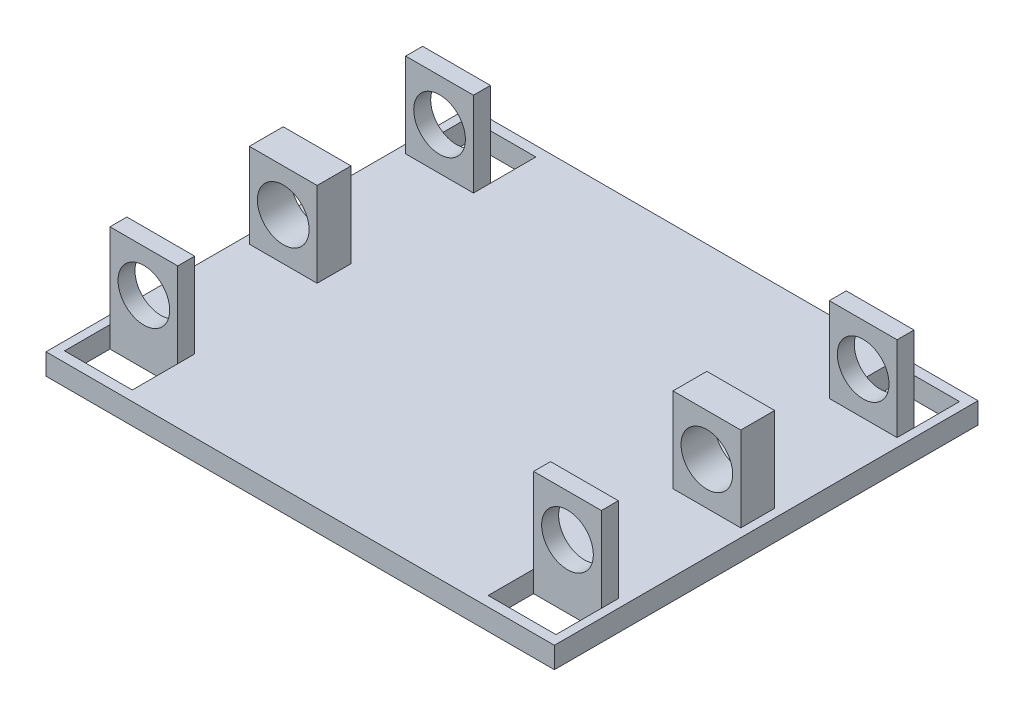
from build123d import *

# Parameters (mm, degrees)
SKETCH1_W           = 60
SKETCH1_H           = 50
BOSS_EXTRUDE1_DEPTH = 2.5
SKETCH2_W           = 8
SKETCH2_H           = 2
BOSS_EXTRUDE2_DEPTH = 10
CUT_EXTRUDE1_REACH  = 44.252
SKETCH3_R           = 3.05
SKETCH4_W           = 8
SKETCH4_H           = 2
BOSS_EXTRUDE3_DEPTH = 10
CUT_EXTRUDE2_REACH  = 44.252
SKETCH6_R           = 3.05
SKETCH7_W           = 8
SKETCH7_H           = 4
BOSS_EXTRUDE4_DEPTH = 10
CUT_EXTRUDE3_REACH  = 44.252
SKETCH8_R           = 3.05
SKETCH9_W           = 8
SKETCH9_H           = 2
BOSS_EXTRUDE5_DEPTH = 10
CUT_EXTRUDE4_REACH  = 56.261
SKETCH10_R          = 3.05
CUT_EXTRUDE5_REACH  = 56.261
SKETCH12_R          = 3.05
CUT_EXTRUDE6_REACH  = 56.261
SKETCH13_R          = 3.05
CUT_EXTRUDE7_REACH  = 56.261
SKETCH14_R          = 3.05
CUT_EXTRUDE8_REACH  = 42.311
SKETCH15_W          = 8
SKETCH15_H          = 5.36479905


with BuildPart() as part:
    # Sketch1 → Boss-Extrude1 (new body)
    with BuildSketch(Plane(origin=(0, 0, 0), x_dir=(1, 0, 0), z_dir=(0, 1, 0))):
        Rectangle(SKETCH1_W, SKETCH1_H)
    extrude(amount=BOSS_EXTRUDE1_DEPTH)

    # Sketch2 → Boss-Extrude2 (add)
    with BuildSketch(Plane(origin=(0, 2.5, 0), x_dir=(1, 0, 0), z_dir=(0, 1, 0))):
        with Locations((-25, -1)):
            Rectangle(SKETCH2_W, SKETCH2_H)
    extrude(amount=BOSS_EXTRUDE2_DEPTH)

    # Sketch3 → Cut-Extrude1 (cut, up to next)
    with BuildSketch(Plane.XY.offset(2), mode=Mode.PRIVATE) as cut_extrude1_sk1:
        with Locations((-25, 7.5)):
            Circle(SKETCH3_R)
    cut_extrude1_tool1 = extrude(cut_extrude1_sk1.sketch, amount=-CUT_EXTRUDE1_REACH, mode=Mode.PRIVATE) & part.part
    add(cut_extrude1_tool1.solids().sort_by_distance((-25, 7.5, 2))[0], mode=Mode.SUBTRACT)

    # Sketch4 → Boss-Extrude3 (add)
    with BuildSketch(Plane(origin=(0, 2.5, 0), x_dir=(1, 0, 0), z_dir=(0, 1, 0))):
        with Locations((-25, 1)):
            Rectangle(SKETCH4_W, SKETCH4_H)
    extrude(amount=BOSS_EXTRUDE3_DEPTH)

    # Sketch6 → Cut-Extrude2 (cut, up to next)
    with BuildSketch(Plane(origin=(0, 0, -2), x_dir=(-1, 0, 0), z_dir=(0, 0, -1)), mode=Mode.PRIVATE) as cut_extrude2_sk1:
        with Locations(Location((25, 7.5, 0), (0, 0, 180))):
            Circle(SKETCH6_R)
    cut_extrude2_tool1 = extrude(cut_extrude2_sk1.sketch, amount=-CUT_EXTRUDE2_REACH, mode=Mode.PRIVATE) & part.part
    add(cut_extrude2_tool1.solids().sort_by_distance((-25, 7.5, -2))[0], mode=Mode.SUBTRACT)

    # Sketch7 → Boss-Extrude4 (add)
    with BuildSketch(Plane(origin=(0, 2.5, 0), x_dir=(1, 0, 0), z_dir=(0, 1, 0))):
        with Locations((25, 0)):
            Rectangle(SKETCH7_W, SKETCH7_H)
    extrude(amount=BOSS_EXTRUDE4_DEPTH)

    # Sketch8 → Cut-Extrude3 (cut, up to next)
    with BuildSketch(Plane.XY.offset(2), mode=Mode.PRIVATE) as cut_extrude3_sk1:
        with Locations((25, 7.5)):
            Circle(SKETCH8_R)
    cut_extrude3_tool1 = extrude(cut_extrude3_sk1.sketch, amount=-CUT_EXTRUDE3_REACH, mode=Mode.PRIVATE) & part.part
    add(cut_extrude3_tool1.solids().sort_by_distance((25, 7.5, 2))[0], mode=Mode.SUBTRACT)

    # Sketch9 → Boss-Extrude5 (add)
    with BuildSketch(Plane(origin=(0, 2.5, 0), x_dir=(1, 0, 0), z_dir=(0, 1, 0))):
        with Locations((-25, 17.450740252)):
            Rectangle(SKETCH9_W, SKETCH9_H)
        with Locations((-25, -17.450740252)):
            Rectangle(SKETCH9_W, SKETCH9_H)
        with Locations((25, -17.450740252)):
            Rectangle(SKETCH9_W, SKETCH9_H)
        with Locations((25, 17.450740252)):
            Rectangle(SKETCH9_W, SKETCH9_H)
    extrude(amount=BOSS_EXTRUDE5_DEPTH)

    # Sketch10 → Cut-Extrude4 (cut, up to next)
    with BuildSketch(Plane(origin=(0, 0, -18.450740252), x_dir=(-1, 0, 0), z_dir=(0, 0, -1)), mode=Mode.PRIVATE) as cut_extrude4_sk1:
        with Locations(Location((25, 7.5, 0), (0, 0, 180))):
            Circle(SKETCH10_R)
    cut_extrude4_tool1 = extrude(cut_extrude4_sk1.sketch, amount=-CUT_EXTRUDE4_REACH, mode=Mode.PRIVATE) & part.part
    add(cut_extrude4_tool1.solids().sort_by_distance((-25, 7.5, -18.45074))[0], mode=Mode.SUBTRACT)

    # Sketch12 → Cut-Extrude5 (cut, up to next)
    with BuildSketch(Plane.XY.offset(18.450740252), mode=Mode.PRIVATE) as cut_extrude5_sk1:
        with Locations((-25, 7.5)):
            Circle(SKETCH12_R)
    cut_extrude5_tool1 = extrude(cut_extrude5_sk1.sketch, amount=-CUT_EXTRUDE5_REACH, mode=Mode.PRIVATE) & part.part
    add(cut_extrude5_tool1.solids().sort_by_distance((-25, 7.5, 18.45074))[0], mode=Mode.SUBTRACT)

    # Sketch13 → Cut-Extrude6 (cut, up to next)
    with BuildSketch(Plane(origin=(0, 0, -18.450740252), x_dir=(-1, 0, 0), z_dir=(0, 0, -1)), mode=Mode.PRIVATE) as cut_extrude6_sk1:
        with Locations(Location((-25, 7.5, 0), (0, 0, 180))):
            Circle(SKETCH13_R)
    cut_extrude6_tool1 = extrude(cut_extrude6_sk1.sketch, amount=-CUT_EXTRUDE6_REACH, mode=Mode.PRIVATE) & part.part
    add(cut_extrude6_tool1.solids().sort_by_distance((25, 7.5, -18.45074))[0], mode=Mode.SUBTRACT)

    # Sketch14 → Cut-Extrude7 (cut, up to next)
    with BuildSketch(Plane.XY.offset(18.450740252), mode=Mode.PRIVATE) as cut_extrude7_sk1:
        with Locations((25, 7.5)):
            Circle(SKETCH14_R)
    cut_extrude7_tool1 = extrude(cut_extrude7_sk1.sketch, amount=-CUT_EXTRUDE7_REACH, mode=Mode.PRIVATE) & part.part
    add(cut_extrude7_tool1.solids().sort_by_distance((25, 7.5, 18.45074))[0], mode=Mode.SUBTRACT)

    # Sketch15 → Cut-Extrude8 (cut, up to next)
    with BuildSketch(Plane(origin=(0, 2.5, 0), x_dir=(1, 0, 0), z_dir=(0, 1, 0)), mode=Mode.PRIVATE) as cut_extrude8_sk1:
        with Locations((-25, 21.133139777)):
            Rectangle(SKETCH15_W, SKETCH15_H)
    cut_extrude8_tool1 = extrude(cut_extrude8_sk1.sketch, amount=-CUT_EXTRUDE8_REACH, mode=Mode.PRIVATE) & part.part
    # Sketch15 → Cut-Extrude8 (cut, up to next)
    with BuildSketch(Plane(origin=(0, 2.5, 0), x_dir=(1, 0, 0), z_dir=(0, 1, 0)), mode=Mode.PRIVATE) as cut_extrude8_sk2:
        with Locations((25, 21.133139777)):
            Rectangle(SKETCH15_W, SKETCH15_H)
    cut_extrude8_tool2 = extrude(cut_extrude8_sk2.sketch, amount=-CUT_EXTRUDE8_REACH, mode=Mode.PRIVATE) & part.part
    # Sketch15 → Cut-Extrude8 (cut, up to next)
    with BuildSketch(Plane(origin=(0, 2.5, 0), x_dir=(1, 0, 0), z_dir=(0, 1, 0)), mode=Mode.PRIVATE) as cut_extrude8_sk3:
        with Locations((-25, -21.133139777)):
            Rectangle(SKETCH15_W, SKETCH15_H)
    cut_extrude8_tool3 = extrude(cut_extrude8_sk3.sketch, amount=-CUT_EXTRUDE8_REACH, mode=Mode.PRIVATE) & part.part
    # Sketch15 → Cut-Extrude8 (cut, up to next)
    with BuildSketch(Plane(origin=(0, 2.5, 0), x_dir=(1, 0, 0), z_dir=(0, 1, 0)), mode=Mode.PRIVATE) as cut_extrude8_sk4:
        with Locations((25, -21.133139777)):
            Rectangle(SKETCH15_W, SKETCH15_H)
    cut_extrude8_tool4 = extrude(cut_extrude8_sk4.sketch, amount=-CUT_EXTRUDE8_REACH, mode=Mode.PRIVATE) & part.part
    add(cut_extrude8_tool1.solids().sort_by_distance((-25, 2.5, -21.13314))[0], mode=Mode.SUBTRACT)
    add(cut_extrude8_tool2.solids().sort_by_distance((25, 2.5, -21.13314))[0], mode=Mode.SUBTRACT)
    add(cut_extrude8_tool3.solids().sort_by_distance((-25, 2.5, 21.13314))[0], mode=Mode.SUBTRACT)
    add(cut_extrude8_tool4.solids().sort_by_distance((25, 2.5, 21.13314))[0], mode=Mode.SUBTRACT)


solid = part.part
